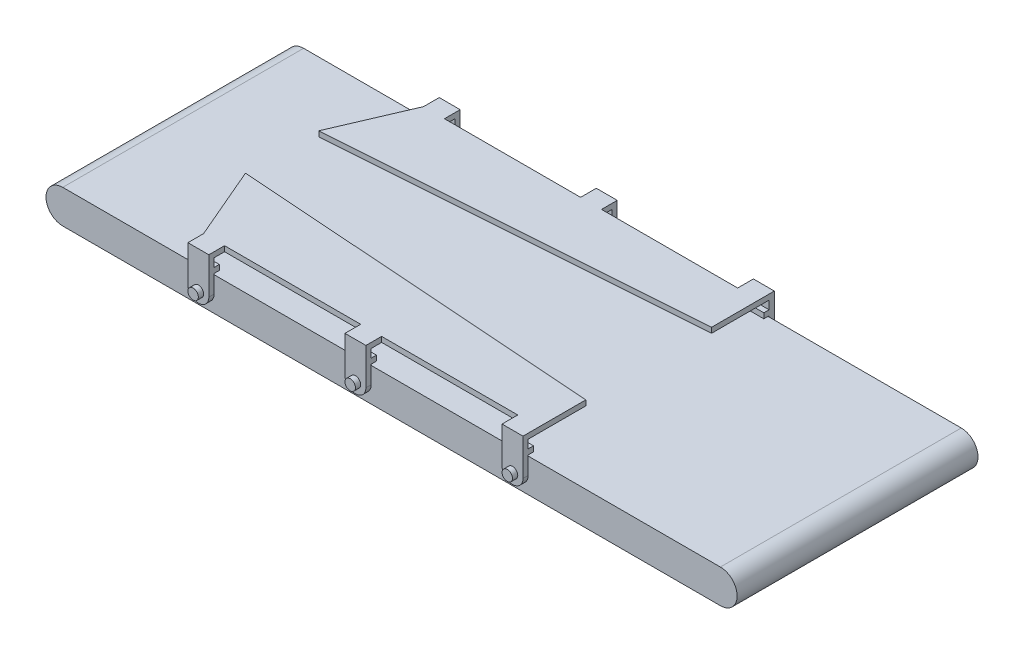
from build123d import *

# Parameters (mm, degrees)
ESBO_O1_W                      = 660
ESBO_O1_H                      = 230
RESSALTO_EXTRUS_O1_DEPTH       = 32
FILETE1_RADIUS                 = 16
FILETE1_LENGTH                 = 230
FILETE2_RADIUS                 = 16
FILETE2_LENGTH                 = 230
ESBO_O2_R                      = 5
RESSALTO_EXTRUS_O2_DEPTH       = 10
PADR_O_LINEAR1_COUNT           = 3
PADR_O_LINEAR1_PITCH           = 150
PADR_O_LINEAR1_COPY_1_SKETCH_R = 5
PADR_O_LINEAR1_COPY_1_DEPTH    = 10
PADR_O_LINEAR1_COPY_2_SKETCH_R = 5
PADR_O_LINEAR1_COPY_2_DEPTH    = 10
ESBO_O6_R                      = 5
RESSALTO_EXTRUS_O7_DEPTH       = 5
ESBO_O10_W                     = 20
ESBO_O10_H                     = 5
RESSALTO_EXTRUS_O11_DEPTH      = 5
PADR_O_LINEAR2_COUNT           = 3
PADR_O_LINEAR2_PITCH           = 150
RESSALTO_EXTRUS_O10_DEPTH      = 5
ESPELHAR2_COPY_1_SKETCH_R      = 5
ESPELHAR2_COPY_1_DEPTH         = 5
ESPELHAR2_COPY_2_SKETCH_R      = 5
ESPELHAR2_COPY_2_DEPTH         = 5
ESPELHAR2_COPY_3_SKETCH_W      = 20
ESPELHAR2_COPY_3_SKETCH_H      = 5
ESPELHAR2_COPY_3_DEPTH         = 5
ESPELHAR2_COPY_4_SKETCH_W      = 20
ESPELHAR2_COPY_4_SKETCH_H      = 5
ESPELHAR2_COPY_4_DEPTH         = 5


with BuildPart() as part:
    # Esboço1 → Ressalto-extrusão1 (new body)
    with BuildSketch(Plane(origin=(0, 0, 0), x_dir=(1, 0, 0), z_dir=(0, 1, 0))):
        with Locations((330, 115)):
            Rectangle(ESBO_O1_W, ESBO_O1_H)
    extrude(amount=RESSALTO_EXTRUS_O1_DEPTH)

    # Filete1: full round fillet: the end face becomes a half cylinder, R = half its width
    filete1_face = Plane((0, 16, -115), x_dir=(0, 0, -1), z_dir=(-1, 0, 0))  # on the end face: x along it, z out of the body
    filete1_slab = filete1_face.offset(-FILETE1_RADIUS / 2) * Box(FILETE1_LENGTH, 2 * FILETE1_RADIUS, FILETE1_RADIUS, mode=Mode.PRIVATE)  # the body's end, R deep
    filete1_round = Plane((16, 16, -115), x_dir=(-1, 0, 0), z_dir=(0, 0, -1)) * Cylinder(FILETE1_RADIUS, FILETE1_LENGTH, mode=Mode.PRIVATE)  # its axis R under the face
    add(filete1_slab - filete1_round, mode=Mode.SUBTRACT)

    # Filete2: full round fillet: the end face becomes a half cylinder, R = half its width
    filete2_face = Plane((660, 16, -115), x_dir=(0, 0, 1), z_dir=(1, 0, 0))  # on the end face: x along it, z out of the body
    filete2_slab = filete2_face.offset(-FILETE2_RADIUS / 2) * Box(FILETE2_LENGTH, 2 * FILETE2_RADIUS, FILETE2_RADIUS, mode=Mode.PRIVATE)  # the body's end, R deep
    filete2_round = Plane((644, 16, -115), x_dir=(1, 0, 0), z_dir=(0, 0, 1)) * Cylinder(FILETE2_RADIUS, FILETE2_LENGTH, mode=Mode.PRIVATE)  # its axis R under the face
    add(filete2_slab - filete2_round, mode=Mode.SUBTRACT)

    # Esboço2 → Ressalto-extrusão2 (add)
    with BuildSketch(Plane.XY):
        with Locations(Location((150.5, 16, 0), (0, 0, 180))):
            Circle(ESBO_O2_R)
    ressalto_extrus_o2 = extrude(amount=RESSALTO_EXTRUS_O2_DEPTH)

    # Espelhar1: Ressalto-extrusão2 across plane
    add(ressalto_extrus_o2.mirror(Plane.XY.offset(-115)))

    # Padrão linear1: Ressalto-extrusão2 ×3
    with Locations(*[(i * PADR_O_LINEAR1_PITCH, 0, 0) for i in range(1, PADR_O_LINEAR1_COUNT)]):
        add(ressalto_extrus_o2)

    # Padrão linear1 copy 1 sketch → Padrão linear1 copy 1 (add)
    with BuildSketch(Plane(origin=(150, 0, -230), x_dir=(1, 0, 0), z_dir=(0, 0, -1))):
        with Locations((150.5, -16)):
            Circle(PADR_O_LINEAR1_COPY_1_SKETCH_R)
    extrude(amount=PADR_O_LINEAR1_COPY_1_DEPTH)

    # Padrão linear1 copy 2 sketch → Padrão linear1 copy 2 (add)
    with BuildSketch(Plane(origin=(300, 0, -230), x_dir=(1, 0, 0), z_dir=(0, 0, -1))):
        with Locations((150.5, -16)):
            Circle(PADR_O_LINEAR1_COPY_2_SKETCH_R)
    extrude(amount=PADR_O_LINEAR1_COPY_2_DEPTH)

    # Esboço6 → Ressalto-extrusão7 (add)
    with BuildSketch(Plane.XY):
        with BuildLine():
            Line((140.5, 16), (140.5, 46))
            Line((140.5, 46), (160.5, 46))
            Line((160.5, 46), (160.5, 16))
            ThreePointArc((160.5, 16), (150.5, 6), (140.5, 16))
        make_face()
        with Locations((150.5, 16)):
            Circle(ESBO_O6_R, mode=Mode.SUBTRACT)
    ressalto_extrus_o7 = extrude(amount=RESSALTO_EXTRUS_O7_DEPTH)

    # Esboço10 → Ressalto-extrusão11 (add)
    with BuildSketch(Plane(origin=(0, 0, 0), x_dir=(-1, 0, 0), z_dir=(0, 0, -1))):
        with Locations((-150.5, 35.5)):
            Rectangle(ESBO_O10_W, ESBO_O10_H)
    ressalto_extrus_o11 = extrude(amount=RESSALTO_EXTRUS_O11_DEPTH)

    # Padrão linear2: Ressalto-extrusão7, Ressalto-extrusão11 ×3
    with Locations(*[(i * PADR_O_LINEAR2_PITCH, 0, 0) for i in range(1, PADR_O_LINEAR2_COUNT)]):
        add(ressalto_extrus_o7)
        add(ressalto_extrus_o11)

    # Esboço9 → Ressalto-extrusão10 (add)
    with BuildSketch(Plane(origin=(0, 46, 0), x_dir=(1, 0, 0), z_dir=(0, 1, 0))):
        Polygon((160.5, -5), (160.5, 10), (290.5, 10), (290.5, -5), (310.5, -5), (310.5, 10), (440.5, 10), (440.5, -5), (460.5, -5), (460.5, 55), (110.5, 80), (140.5, 10), (140.5, -5), align=None)
    ressalto_extrus_o10 = extrude(amount=RESSALTO_EXTRUS_O10_DEPTH)

    # Espelhar2: Ressalto-extrusão7, Ressalto-extrusão11, Ressalto-extrusão10 across plane
    add(ressalto_extrus_o7.mirror(Plane(origin=(0, 0, -115), x_dir=(1, 0, 0), z_dir=(0, 0, -1))))
    add(ressalto_extrus_o11.mirror(Plane(origin=(0, 0, -115), x_dir=(1, 0, 0), z_dir=(0, 0, -1))))
    add(ressalto_extrus_o10.mirror(Plane(origin=(0, 0, -115), x_dir=(1, 0, 0), z_dir=(0, 0, -1))))

    # Espelhar2 copy 1 sketch → Espelhar2 copy 1 (add)
    with BuildSketch(Plane(origin=(150, 0, -230), x_dir=(1, 0, 0), z_dir=(0, 0, -1))):
        with BuildLine():
            Line((140.5, -16), (140.5, -46))
            Line((140.5, -46), (160.5, -46))
            Line((160.5, -46), (160.5, -16))
            ThreePointArc((160.5, -16), (150.5, -6), (140.5, -16))
        make_face()
        with Locations((150.5, -16)):
            Circle(ESPELHAR2_COPY_1_SKETCH_R, mode=Mode.SUBTRACT)
    extrude(amount=ESPELHAR2_COPY_1_DEPTH)

    # Espelhar2 copy 2 sketch → Espelhar2 copy 2 (add)
    with BuildSketch(Plane(origin=(300, 0, -230), x_dir=(1, 0, 0), z_dir=(0, 0, -1))):
        with BuildLine():
            Line((140.5, -16), (140.5, -46))
            Line((140.5, -46), (160.5, -46))
            Line((160.5, -46), (160.5, -16))
            ThreePointArc((160.5, -16), (150.5, -6), (140.5, -16))
        make_face()
        with Locations((150.5, -16)):
            Circle(ESPELHAR2_COPY_2_SKETCH_R, mode=Mode.SUBTRACT)
    extrude(amount=ESPELHAR2_COPY_2_DEPTH)

    # Espelhar2 copy 3 sketch → Espelhar2 copy 3 (add)
    with BuildSketch(Plane(origin=(150, 0, -230), x_dir=(-1, 0, 0), z_dir=(0, 0, 1))):
        with Locations((-150.5, -35.5)):
            Rectangle(ESPELHAR2_COPY_3_SKETCH_W, ESPELHAR2_COPY_3_SKETCH_H)
    extrude(amount=ESPELHAR2_COPY_3_DEPTH)

    # Espelhar2 copy 4 sketch → Espelhar2 copy 4 (add)
    with BuildSketch(Plane(origin=(300, 0, -230), x_dir=(-1, 0, 0), z_dir=(0, 0, 1))):
        with Locations((-150.5, -35.5)):
            Rectangle(ESPELHAR2_COPY_4_SKETCH_W, ESPELHAR2_COPY_4_SKETCH_H)
    extrude(amount=ESPELHAR2_COPY_4_DEPTH)


solid = part.part
